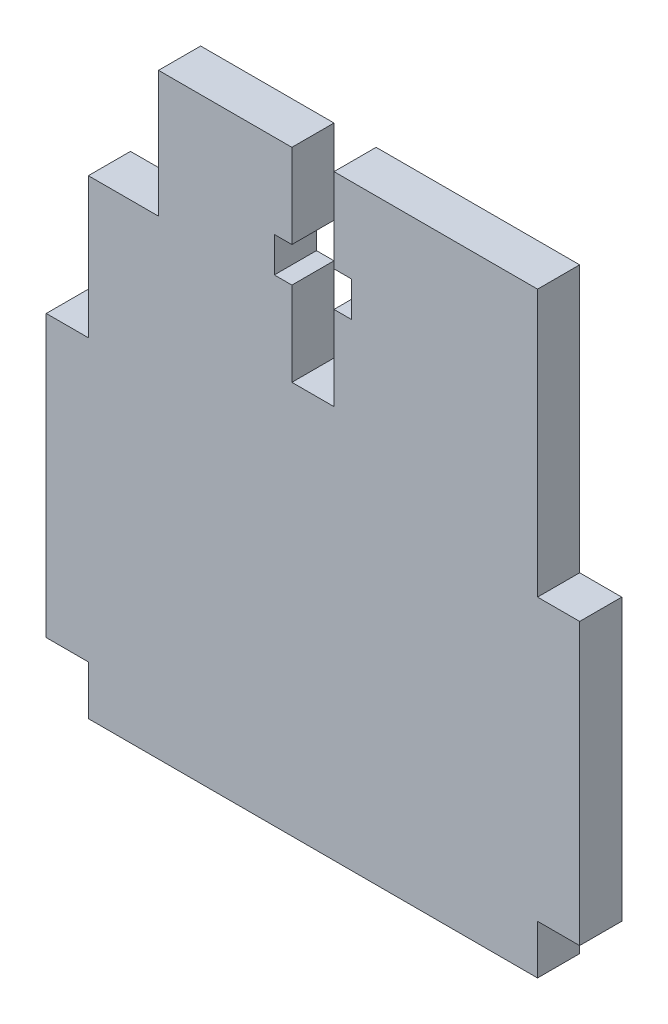
from build123d import *

# Parameters (mm, degrees)
SKETCH_1_W           = 32
SKETCH_1_H           = 42.5
EXTRUDE_1_DEPTH      = 3
EXTRUDE_2_DEPTH      = 3
EXTRUDE_2_DEPTH_BACK = 35
SKETCH_2_W           = 3
SKETCH_2_H           = 20
CUT_EXTRUDE_1_DEPTH  = 3
SKETCH_4_W           = 5
SKETCH_4_H           = 9
CUT_EXTRUDE_2_DEPTH  = 3


with BuildPart() as part:
    # Эскиз1 → Бобышка-Вытянуть1 (new body)
    with BuildSketch(Plane.XY):
        with Locations((16, 21.25)):
            Rectangle(SKETCH_1_W, SKETCH_1_H)
    extrude(amount=EXTRUDE_1_DEPTH)

    # Эскиз2 → Бобышка-Вытянуть2 (add, two sides: drawn at the far end of the back side and taken through both)
    with BuildSketch(Plane(origin=(32, 0, 0), x_dir=(0, 0, -1), z_dir=(1, 0, 0)).offset(-EXTRUDE_2_DEPTH_BACK)):
        with Locations((-1.5, 13.5)):
            Rectangle(SKETCH_2_W, SKETCH_2_H)
    extrude(amount=EXTRUDE_2_DEPTH + EXTRUDE_2_DEPTH_BACK)

    # Эскиз3 → Вырез-Вытянуть1 (cut)
    with BuildSketch(Plane.XY.offset(3)):
        Polygon((14.5, 42.5), (14.5, 36.5), (13.25, 36.5), (13.25, 34), (14.5, 34), (14.5, 28), (17.5, 28), (17.5, 34), (18.75, 34), (18.75, 36.5), (17.5, 36.5), (17.5, 42.5), align=None)
    extrude(amount=-CUT_EXTRUDE_1_DEPTH, mode=Mode.SUBTRACT)

    # Эскиз4 → Вырез-Вытянуть2 (cut)
    with BuildSketch(Plane.XY.offset(3)):
        with Locations((2.5, 38)):
            Rectangle(SKETCH_4_W, SKETCH_4_H)
    extrude(amount=-CUT_EXTRUDE_2_DEPTH, mode=Mode.SUBTRACT)


solid = part.part
